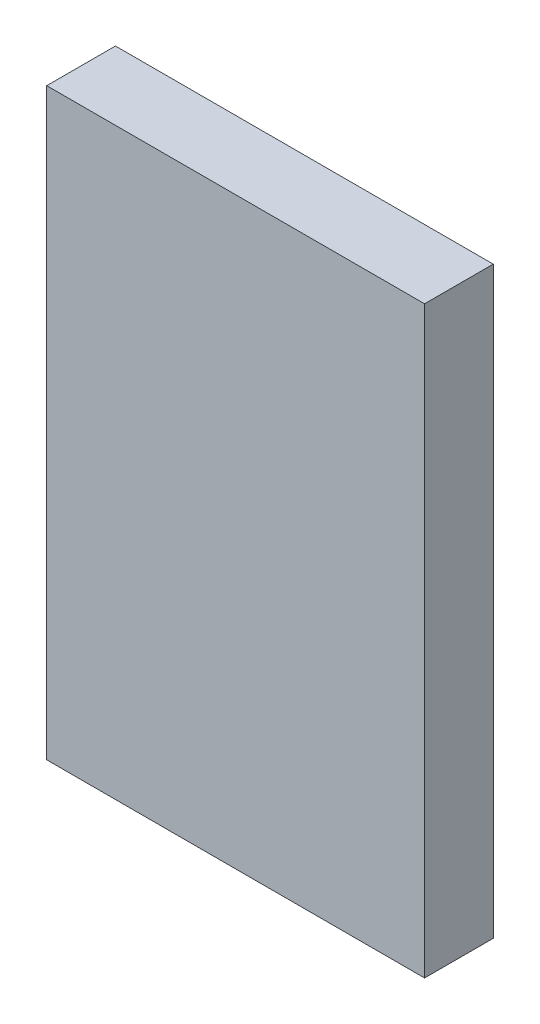
from build123d import *

# Parameters (mm, degrees)
ESQUISSE1_W        = 55
ESQUISSE1_H        = 85
BOSS_EXTRU_1_DEPTH = 10


with BuildPart() as part:
    # Esquisse1 → Boss.-Extru.1 (new body)
    with BuildSketch(Plane.XY):
        Rectangle(ESQUISSE1_W, ESQUISSE1_H)
    extrude(amount=BOSS_EXTRU_1_DEPTH)


solid = part.part
